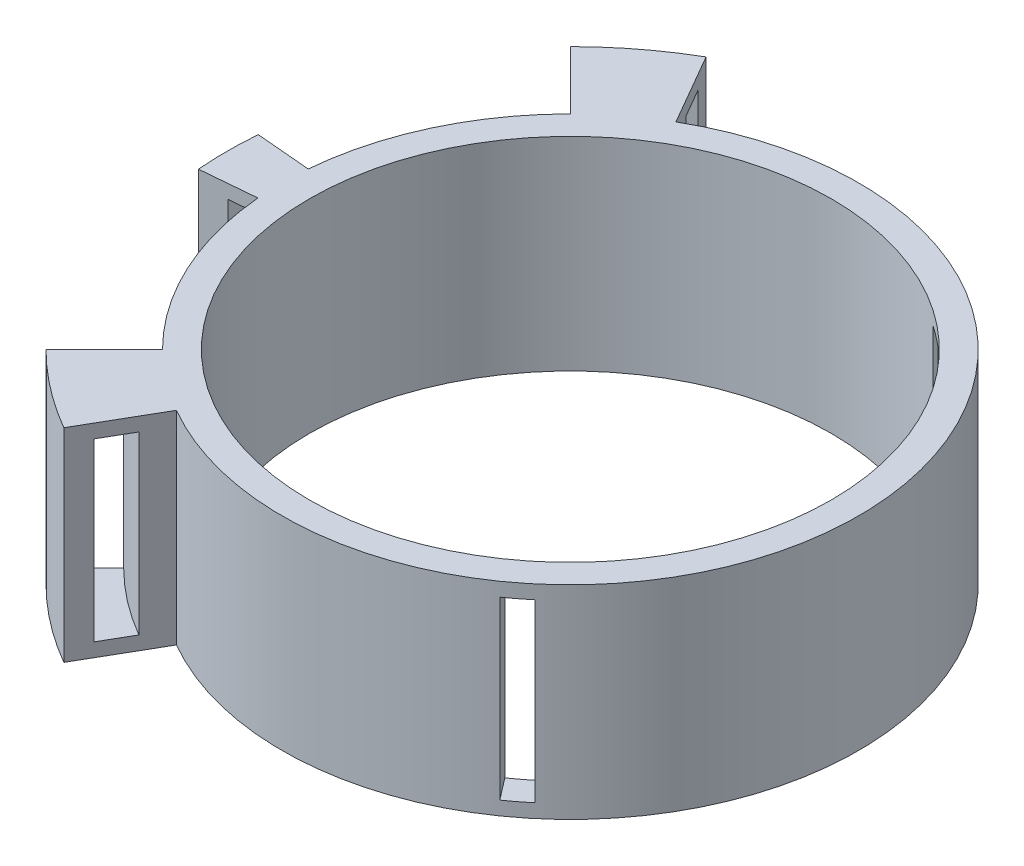
from build123d import *
from build123d.topology import SkipClean

# Parameters (mm, degrees)
EXTRUDE_1_DEPTH = 0.5
EXTRUDE_2_DEPTH = 6.4
EXTRUDE_3_DEPTH = 0.5
EXTRUDE_START   = -7.4
EXTRUDE_6_DEPTH = 7.4
EXTRUDE_7_DEPTH = 6.4
EXTRUDE_8_DEPTH = 0.5


with BuildPart() as part:
    # 草图1 → 凸台-拉伸1 (new body)
    with BuildSketch(Plane(origin=(0, 0, 0), x_dir=(1, 0, 0), z_dir=(0, 1, 0))):
        with BuildLine():
            Line((10.46004433, 0.915135299), (9.463849632, 0.827979556))
            ThreePointArc((9.463849632, 0.827979556), (-9.5, 0), (9.463849632, -0.827979556))
            Line((9.463849632, -0.827979556), (10.46004433, -0.915135299))
            ThreePointArc((10.46004433, -0.915135299), (4.848360439, -9.313613748), (-5.25, -9.09326674))
            Line((-5.25, -9.09326674), (-6.75, -11.691342951))
            ThreePointArc((-6.75, -11.691342951), (-8.218279292, -10.710270094), (-9.545941546, -9.545941546))
            Line((-9.545941546, -9.545941546), (-7.424621202, -7.424621202))
            ThreePointArc((-7.424621202, -7.424621202), (-9.516231764, -4.437491748), (-10.46004433, -0.915135299))
            Line((-10.46004433, -0.915135299), (-12.452433726, -1.089446784))
            ThreePointArc((-12.452433726, -1.089446784), (-12.5, 0), (-12.452433726, 1.089446784))
            Line((-12.452433726, 1.089446784), (-10.46004433, 0.915135299))
            ThreePointArc((-10.46004433, 0.915135299), (-9.516231764, 4.437491748), (-7.424621202, 7.424621202))
            Line((-7.424621202, 7.424621202), (-9.545941546, 9.545941546))
            ThreePointArc((-9.545941546, 9.545941546), (-8.218279292, 10.710270094), (-6.75, 11.691342951))
            Line((-6.75, 11.691342951), (-5.25, 9.09326674))
            ThreePointArc((-5.25, 9.09326674), (4.848360439, 9.313613748), (10.46004433, 0.915135299))
        make_face()
    extrude(amount=EXTRUDE_1_DEPTH)

    # 草图10 → 凸台-拉伸2 (add)
    with BuildSketch(Plane(origin=(0, 0.5, 0), x_dir=(1, 0, 0), z_dir=(0, 1, 0))):
        with BuildLine():
            Line((9.463849632, -0.827979556), (10.46004433, -0.915135299))
            ThreePointArc((10.46004433, -0.915135299), (9.313613748, -4.848360439), (6.749269902, -8.043466653))
            Line((6.749269902, -8.043466653), (6.106482292, -7.27742221))
            ThreePointArc((6.106482292, -7.27742221), (8.426602915, -4.386611826), (9.463849632, -0.827979556))
        make_face()
        with BuildLine():
            Line((9.463849632, 0.827979556), (10.46004433, 0.915135299))
            ThreePointArc((10.46004433, 0.915135299), (9.301536339, 4.87149071), (6.709209057, 8.076912394))
            Line((6.709209057, 8.076912394), (6.070236766, 7.307682642))
            ThreePointArc((6.070236766, 7.307682642), (8.415675735, 4.407539214), (9.463849632, 0.827979556))
        make_face()
        with BuildLine():
            Line((6.027465556, -8.597654271), (5.417844557, -7.803650451))
            ThreePointArc((5.417844557, -7.803650451), (-9.49996943, -0.024100522), (5.378180831, 7.831038944))
            Line((5.378180831, 7.831038944), (5.983810171, 8.628094566))
            ThreePointArc((5.983810171, 8.628094566), (-10.499966281, -0.026610168), (6.027465556, -8.597654271))
        make_face()
    extrude(amount=EXTRUDE_2_DEPTH)

    # 草图11 → 凸台-拉伸3 (add)
    with SkipClean():  # the faces are left unmerged after this step: merging them gives an invalid solid
        with BuildSketch(Plane(origin=(0, 6.9, 0), x_dir=(1, 0, 0), z_dir=(0, 1, 0))):
            with BuildLine():
                Line((9.463849632, 0.827979556), (10.46004433, 0.915135299))
                ThreePointArc((10.46004433, 0.915135299), (-10.5, 0), (10.46004433, -0.915135299))
                Line((10.46004433, -0.915135299), (9.463849632, -0.827979556))
                ThreePointArc((9.463849632, -0.827979556), (-9.5, 0), (9.463849632, 0.827979556))
            make_face()
        extrude(amount=EXTRUDE_3_DEPTH)

    # 草图14 → 凸台-拉伸6 (add)
    with SkipClean():  # the faces are left unmerged after this step: merging them gives an invalid solid
        with BuildSketch(Plane(origin=(0, 7.4, 0), x_dir=(1, 0, 0), z_dir=(0, 1, 0)).offset(EXTRUDE_START)):
            with BuildLine():
                Line((9.463849632, 0.827979556), (10.46004433, 0.915135299))
                ThreePointArc((10.46004433, 0.915135299), (10.5, 0), (10.46004433, -0.915135299))
                Line((10.46004433, -0.915135299), (9.463849632, -0.827979556))
                ThreePointArc((9.463849632, -0.827979556), (9.5, 0), (9.463849632, 0.827979556))
            make_face()
        extrude(amount=EXTRUDE_6_DEPTH)

    # 草图12 → 凸台-拉伸7 (add)
    with SkipClean():  # the faces are left unmerged after this step: merging them gives an invalid solid
        with BuildSketch(Plane(origin=(0, 0.5, 0), x_dir=(1, 0, 0), z_dir=(0, 1, 0))):
            with BuildLine():
                Line((-12.452433726, 1.089446784), (-11.456239028, 1.002291042))
                ThreePointArc((-11.456239028, 1.002291042), (-11.5, 0), (-11.456239028, -1.002291042))
                Line((-11.456239028, -1.002291042), (-12.452433726, -1.089446784))
                ThreePointArc((-12.452433726, -1.089446784), (-12.5, 0), (-12.452433726, 1.089446784))
            make_face()
            with BuildLine():
                Line((-9.545941546, -9.545941546), (-8.980256121, -8.980256121))
                ThreePointArc((-8.980256121, -8.980256121), (-7.731270148, -10.075587422), (-6.35, -10.998522628))
                Line((-6.35, -10.998522628), (-6.75, -11.691342951))
                ThreePointArc((-6.75, -11.691342951), (-8.218279292, -10.710270094), (-9.545941546, -9.545941546))
            make_face()
            with BuildLine():
                Line((-7.424621202, -7.424621202), (-8.131727984, -8.131727984))
                ThreePointArc((-8.131727984, -8.131727984), (-7.000756434, -9.123563413), (-5.75, -9.959292144))
                Line((-5.75, -9.959292144), (-5.25, -9.09326674))
                ThreePointArc((-5.25, -9.09326674), (-6.391995005, -8.330210073), (-7.424621202, -7.424621202))
            make_face()
            with BuildLine():
                Line((-9.545941546, 9.545941546), (-8.980256121, 8.980256121))
                ThreePointArc((-8.980256121, 8.980256121), (-7.731270148, 10.075587422), (-6.35, 10.998522628))
                Line((-6.35, 10.998522628), (-6.75, 11.691342951))
                ThreePointArc((-6.75, 11.691342951), (-8.218279292, 10.710270094), (-9.545941546, 9.545941546))
            make_face()
            with BuildLine():
                Line((-7.424621202, 7.424621202), (-8.131727984, 8.131727984))
                ThreePointArc((-8.131727984, 8.131727984), (-7.000756434, 9.123563413), (-5.75, 9.959292144))
                Line((-5.75, 9.959292144), (-5.25, 9.09326674))
                ThreePointArc((-5.25, 9.09326674), (-6.391995005, 8.330210073), (-7.424621202, 7.424621202))
            make_face()
        extrude(amount=EXTRUDE_7_DEPTH)

    # 草图15 → 凸台-拉伸8 (add)
    with SkipClean():  # the faces are left unmerged after this step: merging them gives an invalid solid
        with BuildSketch(Plane(origin=(0, 6.9, 0), x_dir=(1, 0, 0), z_dir=(0, 1, 0))):
            with BuildLine():
                Line((-12.452433726, 1.089446784), (-10.46004433, 0.915135299))
                ThreePointArc((-10.46004433, 0.915135299), (-10.5, 0), (-10.46004433, -0.915135299))
                Line((-10.46004433, -0.915135299), (-12.452433726, -1.089446784))
                ThreePointArc((-12.452433726, -1.089446784), (-12.49816394, 0), (-12.452433726, 1.089446784))
            make_face()
            with BuildLine():
                Line((-9.545941546, -9.545941546), (-7.424621202, -7.424621202))
                ThreePointArc((-7.424621202, -7.424621202), (-6.391995005, -8.330210073), (-5.25, -9.09326674))
                Line((-5.25, -9.09326674), (-6.75, -11.691342951))
                ThreePointArc((-6.75, -11.691342951), (-8.218279292, -10.710270094), (-9.545941546, -9.545941546))
            make_face()
            with BuildLine():
                Line((-9.545941546, 9.545941546), (-7.424621202, 7.424621202))
                ThreePointArc((-7.424621202, 7.424621202), (-6.391995005, 8.330210073), (-5.25, 9.09326674))
                Line((-5.25, 9.09326674), (-6.75, 11.691342951))
                ThreePointArc((-6.75, 11.691342951), (-8.218279292, 10.710270094), (-9.545941546, 9.545941546))
            make_face()
        extrude(amount=EXTRUDE_8_DEPTH)


solid = part.part
